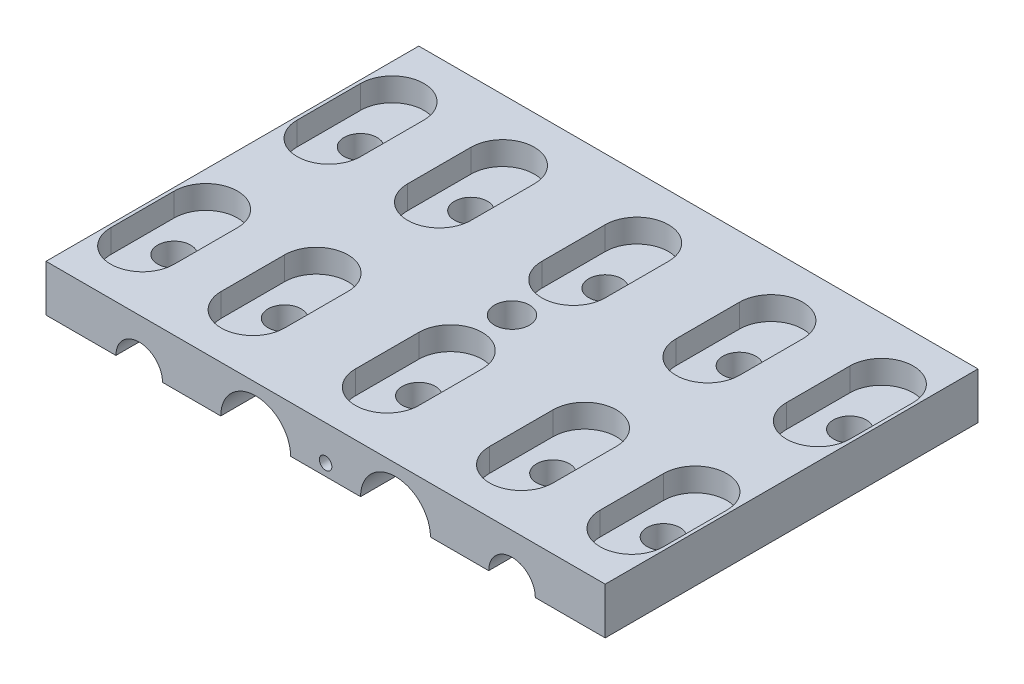
from build123d import *

# Parameters (mm, degrees)
SKETCH1_W             = 76.2
SKETCH1_H             = 50.8
BOSS_EXTRUDE1_DEPTH   = 6.35
SKETCH2_R             = 3.175
CUT_EXTRUDE1_DEPTH    = 64.816710194
SKETCH3_R             = 4.7625
CUT_EXTRUDE2_DEPTH    = 64.816710194
F_8_CLEARANCE_HOLE1_D = 4.4958
CUT_EXTRUDE3_DEPTH    = 3.175
SKETCH7_R             = 2.38125
CUT_EXTRUDE4_DEPTH    = 47.228697797
SKETCH8_R             = 0.8509
CUT_EXTRUDE5_DEPTH    = 9.525


with BuildPart() as part:
    # Sketch1 → Boss-Extrude1 (new body)
    with BuildSketch(Plane(origin=(0, 0, 0), x_dir=(1, 0, 0), z_dir=(0, 1, 0))):
        Rectangle(SKETCH1_W, SKETCH1_H)
    extrude(amount=BOSS_EXTRUDE1_DEPTH)

    # Sketch2 → Cut-Extrude1 (cut, through all)
    with BuildSketch(Plane.XY.offset(25.4)):
        with Locations((-25.4, 0)):
            Circle(SKETCH2_R)
        with Locations((25.4, 0)):
            Circle(SKETCH2_R)
    extrude(amount=-CUT_EXTRUDE1_DEPTH, mode=Mode.SUBTRACT)

    # Sketch3 → Cut-Extrude2 (cut, through all)
    with BuildSketch(Plane.XY.offset(25.4)):
        with Locations((-9.525, 0)):
            Circle(SKETCH3_R)
        with Locations((9.525, 0)):
            Circle(SKETCH3_R)
    extrude(amount=-CUT_EXTRUDE2_DEPTH, mode=Mode.SUBTRACT)

    # #8 Clearance Hole1 (through all)
    with Locations(Plane(origin=(0, 6.35, 0), x_dir=(1, 0, 0), z_dir=(0, 1, 0))):
        with Locations((-33.3375, 12.7), (-33.3375, -12.7), (-18.288, -12.7), (0, -12.7), (18.288, -12.7), (33.3375, -12.7), (33.3375, 12.7), (18.288, 12.7), (0, 12.7), (-18.288, 12.7)):
            Hole(F_8_CLEARANCE_HOLE1_D / 2)

    # Sketch6 → Cut-Extrude3 (cut)
    with BuildSketch(Plane(origin=(0, 6.35, 0), x_dir=(1, 0, 0), z_dir=(0, 1, 0))):
        with BuildLine():
            Line((-13.97, 17.018), (-13.97, 8.382))
            ThreePointArc((-13.97, 8.382), (-18.288, 4.064), (-22.606, 8.382))
            Line((-22.606, 8.382), (-22.606, 17.018))
            ThreePointArc((-22.606, 17.018), (-18.288, 21.336), (-13.97, 17.018))
        make_face()
        with BuildLine():
            Line((13.97, 17.018), (13.97, 8.382))
            ThreePointArc((13.97, 8.382), (18.288, 4.064), (22.606, 8.382))
            Line((22.606, 8.382), (22.606, 17.018))
            ThreePointArc((22.606, 17.018), (18.288, 21.336), (13.97, 17.018))
        make_face()
        with BuildLine():
            Line((13.97, -17.018), (13.97, -8.382))
            ThreePointArc((13.97, -8.382), (18.288, -4.064), (22.606, -8.382))
            Line((22.606, -8.382), (22.606, -17.018))
            ThreePointArc((22.606, -17.018), (18.288, -21.336), (13.97, -17.018))
        make_face()
        with BuildLine():
            Line((-13.97, -17.018), (-13.97, -8.382))
            ThreePointArc((-13.97, -8.382), (-18.288, -4.064), (-22.606, -8.382))
            Line((-22.606, -8.382), (-22.606, -17.018))
            ThreePointArc((-22.606, -17.018), (-18.288, -21.336), (-13.97, -17.018))
        make_face()
        with BuildLine():
            Line((4.318, 17.018), (4.318, 8.382))
            ThreePointArc((4.318, 8.382), (0, 4.064), (-4.318, 8.382))
            Line((-4.318, 8.382), (-4.318, 17.018))
            ThreePointArc((-4.318, 17.018), (0, 21.336), (4.318, 17.018))
        make_face()
        with BuildLine():
            Line((4.318, -17.018), (4.318, -8.382))
            ThreePointArc((4.318, -8.382), (0, -4.064), (-4.318, -8.382))
            Line((-4.318, -8.382), (-4.318, -17.018))
            ThreePointArc((-4.318, -17.018), (0, -21.336), (4.318, -17.018))
        make_face()
        with BuildLine():
            Line((-29.0195, 17.018), (-29.0195, 8.382))
            ThreePointArc((-29.0195, 8.382), (-33.3375, 4.064), (-37.6555, 8.382))
            Line((-37.6555, 8.382), (-37.6555, 17.018))
            ThreePointArc((-37.6555, 17.018), (-33.3375, 21.336), (-29.0195, 17.018))
        make_face()
        with BuildLine():
            Line((-29.0195, -17.018), (-29.0195, -8.382))
            ThreePointArc((-29.0195, -8.382), (-33.3375, -4.064), (-37.6555, -8.382))
            Line((-37.6555, -8.382), (-37.6555, -17.018))
            ThreePointArc((-37.6555, -17.018), (-33.3375, -21.336), (-29.0195, -17.018))
        make_face()
        with BuildLine():
            Line((29.0195, 17.018), (29.0195, 8.382))
            ThreePointArc((29.0195, 8.382), (33.3375, 4.064), (37.6555, 8.382))
            Line((37.6555, 8.382), (37.6555, 17.018))
            ThreePointArc((37.6555, 17.018), (33.3375, 21.336), (29.0195, 17.018))
        make_face()
        with BuildLine():
            Line((29.0195, -17.018), (29.0195, -8.382))
            ThreePointArc((29.0195, -8.382), (33.3375, -4.064), (37.6555, -8.382))
            Line((37.6555, -8.382), (37.6555, -17.018))
            ThreePointArc((37.6555, -17.018), (33.3375, -21.336), (29.0195, -17.018))
        make_face()
    extrude(amount=-CUT_EXTRUDE3_DEPTH, mode=Mode.SUBTRACT)

    # Sketch7 → Cut-Extrude4 (cut, through all)
    with BuildSketch(Plane(origin=(0, 6.35, 0), x_dir=(1, 0, 0), z_dir=(0, 1, 0))):
        with Locations(Location((0, 0, 0), (0, 0, 270))):
            Circle(SKETCH7_R)
    extrude(amount=-CUT_EXTRUDE4_DEPTH, mode=Mode.SUBTRACT)

    # Sketch8 → Cut-Extrude5 (cut)
    with BuildSketch(Plane.XY.offset(25.4)):
        with Locations((0, 1.5875)):
            Circle(SKETCH8_R)
    extrude(amount=-CUT_EXTRUDE5_DEPTH, mode=Mode.SUBTRACT)


solid = part.part
